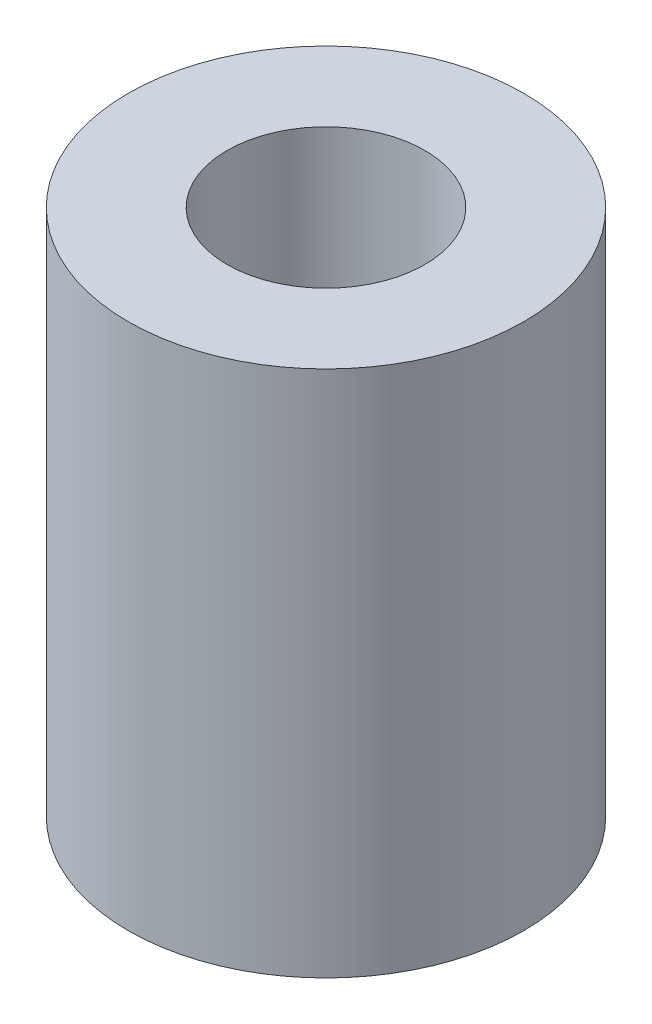
from build123d import *

# Parameters (mm, degrees)
SKETCH1_R           = 3
SKETCH1_R_2         = 1.5
BOSS_EXTRUDE1_DEPTH = 8


with BuildPart() as part:
    # Sketch1 → Boss-Extrude1 (new body)
    with BuildSketch(Plane(origin=(0, 0, 0), x_dir=(1, 0, 0), z_dir=(0, 1, 0))):
        with Locations(Location((0, 0, 0), (0, 0, 270))):
            Circle(SKETCH1_R)
        with Locations(Location((0, 0, 0), (0, 0, 270))):
            Circle(SKETCH1_R_2, mode=Mode.SUBTRACT)
    extrude(amount=BOSS_EXTRUDE1_DEPTH)


solid = part.part
